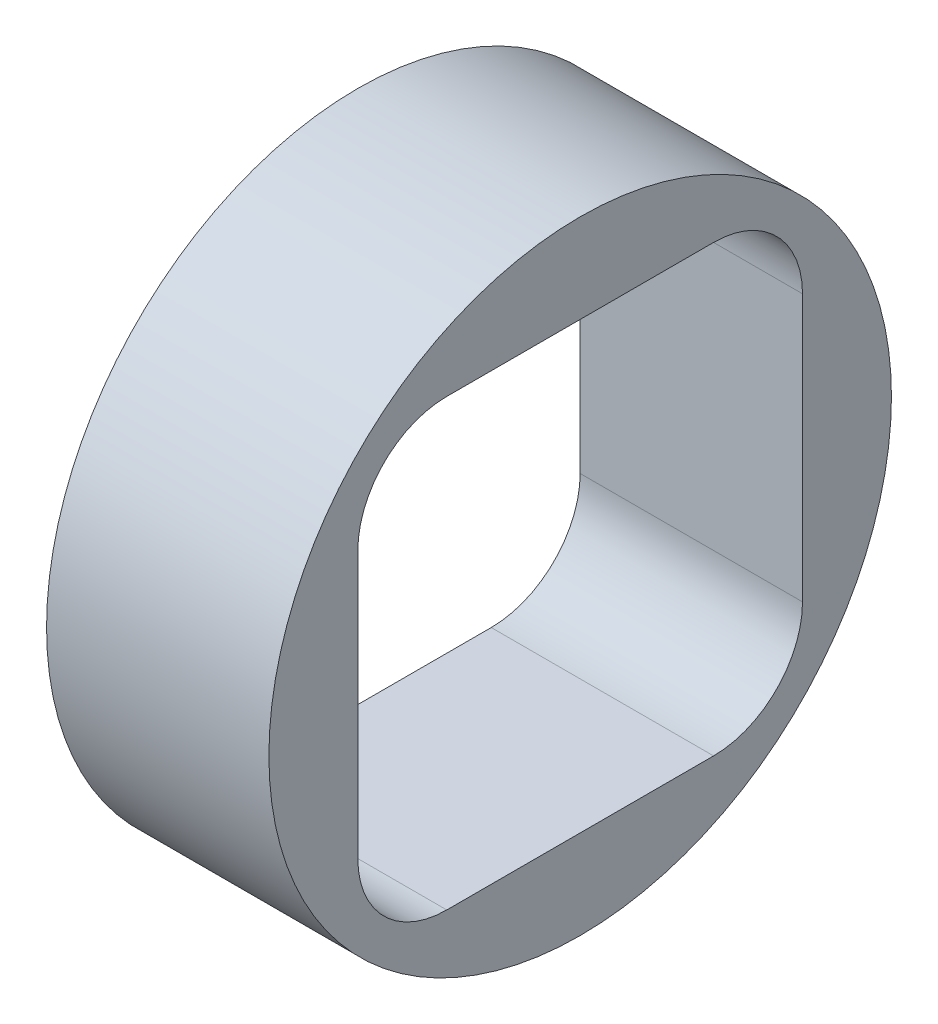
from build123d import *

# Parameters (mm, degrees)
SKETCH2_R           = 4.445
BOSS_EXTRUDE1_DEPTH = 3.175


with BuildPart() as part:
    # Sketch2 → Boss-Extrude1 (new body)
    with BuildSketch(Plane(origin=(0, 0, 0), x_dir=(0, 0, -1), z_dir=(1, 0, 0))):
        Circle(SKETCH2_R)
        with BuildLine():
            Line((1.905, 3.175), (-1.905, 3.175))
            ThreePointArc((-1.905, 3.175), (-2.803025612, 2.803025612), (-3.175, 1.905))
            Line((-3.175, 1.905), (-3.175, -1.905))
            ThreePointArc((-3.175, -1.905), (-2.803025612, -2.803025612), (-1.905, -3.175))
            Line((-1.905, -3.175), (1.905, -3.175))
            ThreePointArc((1.905, -3.175), (2.803025612, -2.803025612), (3.175, -1.905))
            Line((3.175, -1.905), (3.175, 1.905))
            ThreePointArc((3.175, 1.905), (2.803025612, 2.803025612), (1.905, 3.175))
        make_face(mode=Mode.SUBTRACT)
    extrude(amount=BOSS_EXTRUDE1_DEPTH)


solid = part.part
